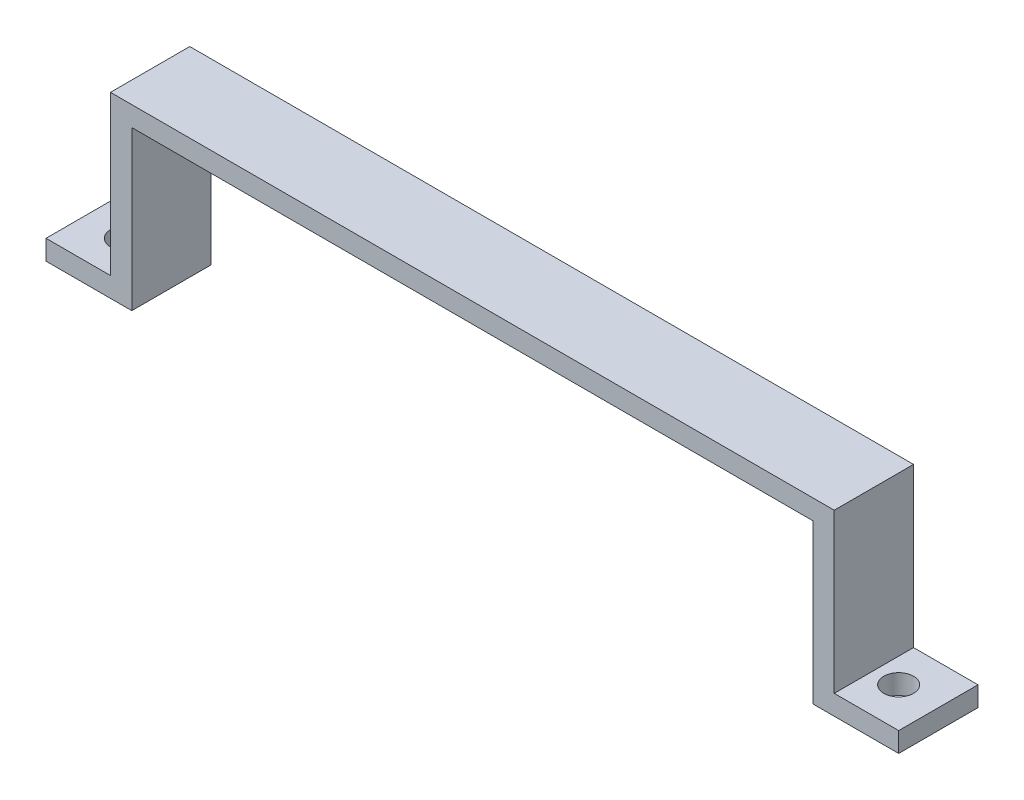
from build123d import *

# Parameters (mm, degrees)
SKETCH_1_W      = 73
SKETCH_1_H      = 8
EXTRUDE_1_DEPTH = 2
SKETCH_1_15_W   = 2.15
SKETCH_1_15_H   = 8
EXTRUDE_2_DEPTH = 16
EXTRUDE_START   = -16
SKETCH_1_16_W   = 6.5
SKETCH_1_16_H   = 8
SKETCH_1_16_R   = 1.5
EXTRUDE_3_DEPTH = 2


with BuildPart() as part:
    # 草图1 → 凸台-拉伸1 (new body)
    with BuildSketch(Plane(origin=(0, 0, 0), x_dir=(1, 0, 0), z_dir=(0, 1, 0))):
        Rectangle(SKETCH_1_W, SKETCH_1_H)
    extrude(amount=EXTRUDE_1_DEPTH)

    # 草图1<15> → 凸台-拉伸2 (add)
    with BuildSketch(Plane(origin=(0, 0, 0), x_dir=(1, 0, 0), z_dir=(0, 1, 0))):
        with Locations((-35.425, 0)):
            Rectangle(SKETCH_1_15_W, SKETCH_1_15_H)
        with Locations((35.425, 0)):
            Rectangle(SKETCH_1_15_W, SKETCH_1_15_H)
    extrude(amount=-EXTRUDE_2_DEPTH)

    # 草图1<16> → 凸台-拉伸3 (add)
    # profile 1 of 2: a face of its own
    with BuildSketch(Plane(origin=(0, 0, 0), x_dir=(1, 0, 0), z_dir=(0, 1, 0)).offset(EXTRUDE_START)):
        with Locations((-39.75, 0)):
            Rectangle(SKETCH_1_16_W, SKETCH_1_16_H)
        with Locations(Location((-39, 0, 0), (0, 0, 270))):
            Circle(SKETCH_1_16_R, mode=Mode.SUBTRACT)
    # profile 2 of 2: a face of its own
    with BuildSketch(Plane(origin=(0, 0, 0), x_dir=(1, 0, 0), z_dir=(0, 1, 0)).offset(EXTRUDE_START)):
        with Locations((39.75, 0)):
            Rectangle(SKETCH_1_16_W, SKETCH_1_16_H)
        with Locations(Location((39, 0, 0), (0, 0, 270))):
            Circle(SKETCH_1_16_R, mode=Mode.SUBTRACT)
    extrude(amount=EXTRUDE_3_DEPTH)


solid = part.part
